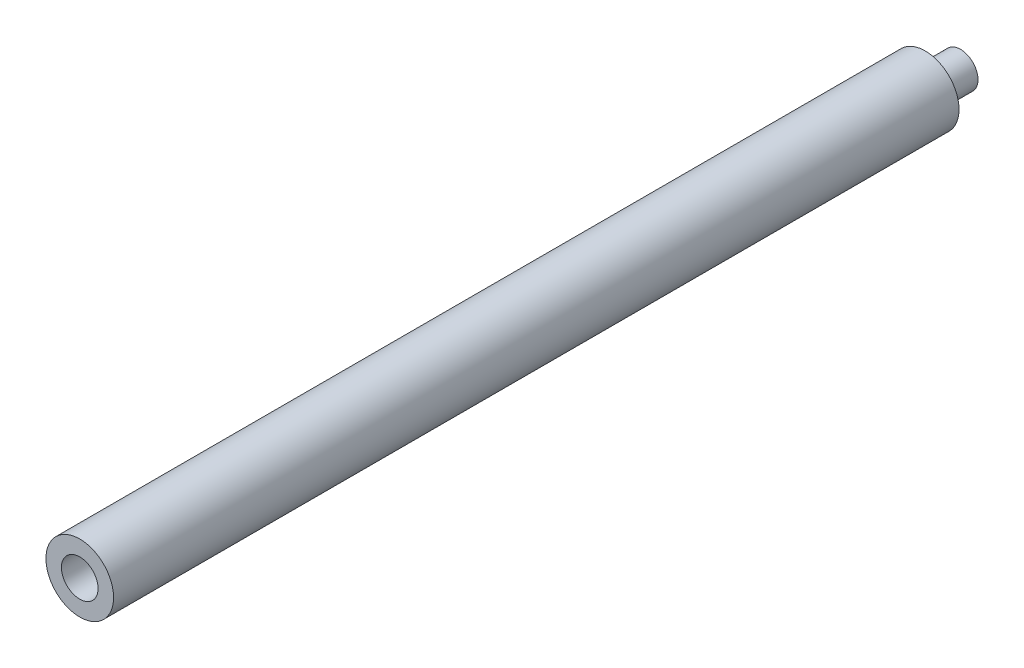
from build123d import *

# Parameters (mm, degrees)
SKETCH1_R           = 2.4
BOSS_EXTRUDE1_DEPTH = 60
SKETCH6_R           = 1.25
BOSS_EXTRUDE2_DEPTH = 2.5
SKETCH7_R           = 1.3
CUT_EXTRUDE1_DEPTH  = 2.5


with BuildPart() as part:
    # Sketch1 → Boss-Extrude1 (new body)
    with BuildSketch(Plane.XY):
        Circle(SKETCH1_R)
    extrude(amount=BOSS_EXTRUDE1_DEPTH)

    # Sketch6 → Boss-Extrude2 (add)
    with BuildSketch(Plane(origin=(0, 0, 0), x_dir=(-1, 0, 0), z_dir=(0, 0, -1))):
        Circle(SKETCH6_R)
    extrude(amount=BOSS_EXTRUDE2_DEPTH)

    # Sketch7 → Cut-Extrude1 (cut)
    with BuildSketch(Plane.XY.offset(60)):
        Circle(SKETCH7_R)
    extrude(amount=-CUT_EXTRUDE1_DEPTH, mode=Mode.SUBTRACT)


solid = part.part
